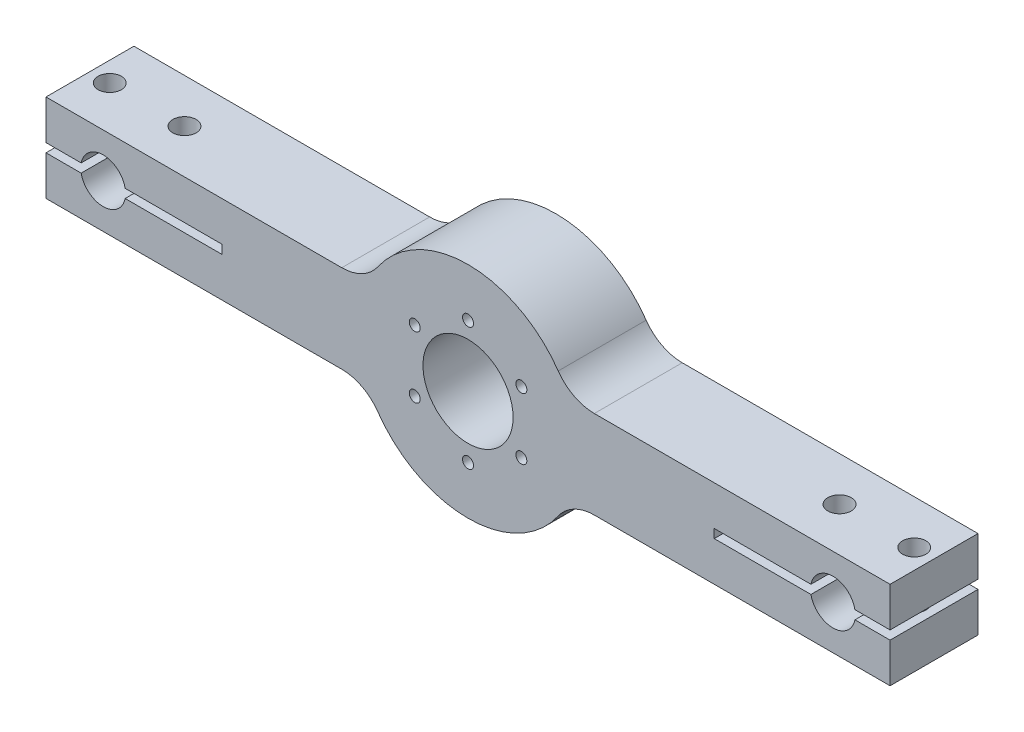
from build123d import *

# Parameters (mm, degrees)
CROQUIS1_W                            = 192
CROQUIS1_H                            = 20
SALIENTE_EXTRUIR1_DEPTH               = 10
TALADRO_DE_MARGEN_PARA_M81_D          = 10.2
TALADRO_DE_MARGEN_PARA_M81_DEPTH      = 200
TALADRO_DE_MARGEN_PARA_M81_TIP        = 3.064389157
CROQUIS5_W                            = 40
CROQUIS5_H                            = 2
CORTAR_EXTRUIR1_DEPTH                 = 20
TALADRO_DE_MARGEN_PARA_M51_AT_2_COUNT = 2
TALADRO_DE_MARGEN_PARA_M51_AT_2_PITCH = 17
CROQUIS10_R                           = 25
SALIENTE_EXTRUIR2_DEPTH               = 20
CROQUIS11_R                           = 10.25
CORTAR_EXTRUIR2_DEPTH                 = 30
REDONDEO1_R                           = 10
MATRIZC1_COUNT                        = 6


with BuildPart() as part:
    # Croquis1 → Saliente-Extruir1 (new, symmetric)
    with BuildSketch(Plane.XY):
        Rectangle(CROQUIS1_W, CROQUIS1_H)
    extrude(amount=SALIENTE_EXTRUIR1_DEPTH, both=True)

    # Taladro de margen para M81
    with Locations(Plane.XY.offset(10)):
        with Locations((-83, 0), (83, 0)):
            Hole(TALADRO_DE_MARGEN_PARA_M81_D / 2, depth=TALADRO_DE_MARGEN_PARA_M81_DEPTH)
            with Locations((0, 0, -(TALADRO_DE_MARGEN_PARA_M81_DEPTH + TALADRO_DE_MARGEN_PARA_M81_TIP / 2))):  # 118° drill point
                Cone(0, TALADRO_DE_MARGEN_PARA_M81_D / 2, TALADRO_DE_MARGEN_PARA_M81_TIP, mode=Mode.SUBTRACT)

    # Croquis5 → Cortar-Extruir1 (cut)
    with BuildSketch(Plane.XY.offset(10)):
        with Locations((-76, 0)):
            Rectangle(CROQUIS5_W, CROQUIS5_H)
    cortar_extruir1 = extrude(amount=-CORTAR_EXTRUIR1_DEPTH, mode=Mode.SUBTRACT)

    # Croquis8 → Taladro de margen para M51 (revolve, cut)
    with BuildSketch(Plane(origin=(-91.5, -10, 0), x_dir=(0, 0, -1), z_dir=(1, 0, 0))):
        Polygon((0, 0), (0, 201.59228064), (2.65, 200), (2.65, 0), align=None)
    taladro_de_margen_para_m51 = revolve(axis=Axis((-91.5, -16.35, 0), (0, 1, 0)), mode=Mode.SUBTRACT)

    # Taladro de margen para M51 at 2: Taladro de margen para M51 ×2
    with Locations(*[(i * TALADRO_DE_MARGEN_PARA_M51_AT_2_PITCH, 0, 0) for i in range(1, TALADRO_DE_MARGEN_PARA_M51_AT_2_COUNT)]):
        add(taladro_de_margen_para_m51, mode=Mode.SUBTRACT)

    # Simetría1: Cortar-Extruir1, Taladro de margen para M51 across plane
    add(cortar_extruir1.mirror(Plane(origin=(0, 0, 0), x_dir=(0, 0, 1), z_dir=(1, 0, 0))), mode=Mode.SUBTRACT)
    add(taladro_de_margen_para_m51.mirror(Plane(origin=(0, 0, 0), x_dir=(0, 0, 1), z_dir=(1, 0, 0))), mode=Mode.SUBTRACT)

    # Simetría1 copy 1 sketch → Simetría1 copy 1 (revolve, cut)
    with BuildSketch(Plane(origin=(74.5, -10, 0), x_dir=(0, 0, -1), z_dir=(-1, 0, 0))):
        Polygon((0, 0), (0, -201.59228064), (2.65, -200), (2.65, 0), align=None)
    revolve(axis=Axis((74.5, -16.35, 0), (0, -1, 0)), mode=Mode.SUBTRACT)

    # Croquis10 → Saliente-Extruir2 (add)
    with BuildSketch(Plane.XY.offset(10)):
        Circle(CROQUIS10_R)
    extrude(amount=-SALIENTE_EXTRUIR2_DEPTH)

    # Croquis11 → Cortar-Extruir2 (cut)
    with BuildSketch(Plane.XY.offset(10)):
        Circle(CROQUIS11_R)
    extrude(amount=-CORTAR_EXTRUIR2_DEPTH, mode=Mode.SUBTRACT)

    # Redondeo1
    redondeo1_edges = [part.edges().sort_by_distance(p)[0] for p in [
        (-22.912878475, 10, 0),
        (22.912878475, 10, 0),
        (-22.912878475, -10, 0),
        (22.912878475, -10, 0),
    ]]
    fillet(redondeo1_edges, radius=REDONDEO1_R)

    # Croquis12 → Taladro roscado M31 (revolve, cut)
    with BuildSketch(Plane(origin=(0, 14, 10), x_dir=(0, -1, 0), z_dir=(1, 0, 0))):
        Polygon((0, 0), (0, 20.751075774), (1.25, 20), (1.25, 0), align=None)
    taladro_roscado_m31 = revolve(axis=Axis((0, 14, 16.35), (0, 0, -1)), mode=Mode.SUBTRACT)

    # MatrizC1: Taladro roscado M31 ×6 about axis
    matrizc1_axis = Axis((0, 0, 0), (0, 0, 1))
    for i in range(1, MATRIZC1_COUNT):
        add(taladro_roscado_m31.rotate(matrizc1_axis, i * 360 / MATRIZC1_COUNT), mode=Mode.SUBTRACT)


solid = part.part
